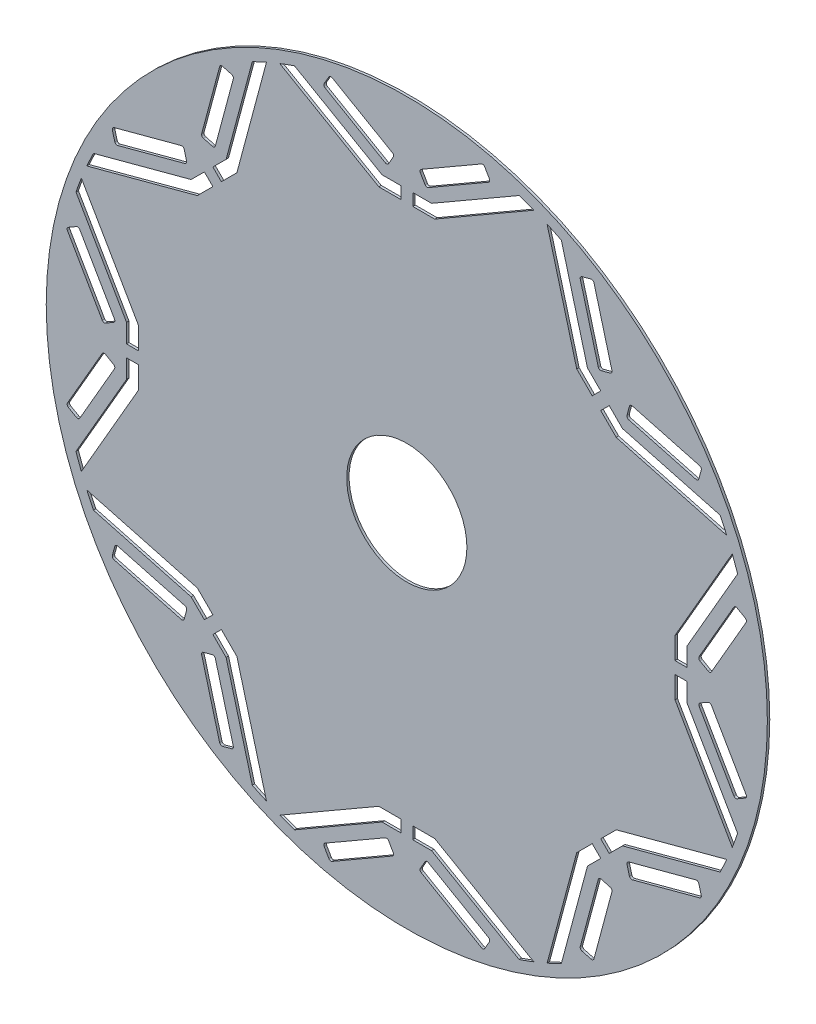
from build123d import *

# Parameters (mm, degrees)
ROTOR_SKETCH_R      = 45
ROTOR_SKETCH_R_2    = 7.5
BOSS_EXTRUDE1_DEPTH = 0.15
CUT_EXTRUDE1_DEPTH  = 64.64031741


with BuildPart() as part:
    # Rotor sketch → Boss-Extrude1 (new, symmetric)
    with BuildSketch(Plane.XY):
        Circle(ROTOR_SKETCH_R)
        Circle(ROTOR_SKETCH_R_2, mode=Mode.SUBTRACT)
        with BuildLine():
            Line((2.683949748, 36.477135035), (10.201050252, 40.817135035))
            ThreePointArc((10.201050252, 40.817135035), (10.340828, 40.999296943), (10.310857874, 41.226942656))
            Line((10.310857874, 41.226942656), (9.725857874, 42.240192379))
            ThreePointArc((9.725857874, 42.240192379), (9.543695966, 42.379970127), (9.316050252, 42.35))
            Line((9.316050252, 42.35), (1.798949748, 38.01))
            ThreePointArc((1.798949748, 38.01), (1.659172, 37.827838092), (1.689142126, 37.600192379))
            Line((1.689142126, 37.600192379), (2.274142126, 36.586942656))
            ThreePointArc((2.274142126, 36.586942656), (2.456304034, 36.447164909), (2.683949748, 36.477135035))
        make_face(mode=Mode.SUBTRACT)
        with BuildLine():
            Line((-1.798949748, 38.01), (-9.316050252, 42.35))
            ThreePointArc((-9.316050252, 42.35), (-9.543695966, 42.379970127), (-9.725857874, 42.240192379))
            Line((-9.725857874, 42.240192379), (-10.310857874, 41.226942656))
            ThreePointArc((-10.310857874, 41.226942656), (-10.340828, 40.999296943), (-10.201050252, 40.817135035))
            Line((-10.201050252, 40.817135035), (-2.683949748, 36.477135035))
            ThreePointArc((-2.683949748, 36.477135035), (-2.456304034, 36.447164909), (-2.274142126, 36.586942656))
            Line((-2.274142126, 36.586942656), (-1.689142126, 37.600192379))
            ThreePointArc((-1.689142126, 37.600192379), (-1.659172, 37.827838092), (-1.798949748, 38.01))
        make_face(mode=Mode.SUBTRACT)
        with BuildLine():
            Line((25.605079187, 28.149178318), (23.358529876, 36.533414491))
            ThreePointArc((23.358529876, 36.533414491), (23.218752128, 36.715576398), (22.991106414, 36.745546525))
            Line((22.991106414, 36.745546525), (21.860973198, 36.442728242))
            ThreePointArc((21.860973198, 36.442728242), (21.67881129, 36.302950494), (21.648841163, 36.075304781))
            Line((21.648841163, 36.075304781), (23.895390475, 27.691068609))
            ThreePointArc((23.895390475, 27.691068609), (24.035168223, 27.508906701), (24.262813936, 27.478936574))
            Line((24.262813936, 27.478936574), (25.392947153, 27.781754857))
            ThreePointArc((25.392947153, 27.781754857), (25.575109061, 27.921532605), (25.605079187, 28.149178318))
        make_face(mode=Mode.SUBTRACT)
        with BuildLine():
            Line((27.478936574, 24.262813936), (27.781754857, 25.392947153))
            ThreePointArc((27.781754857, 25.392947153), (27.921532605, 25.575109061), (28.149178318, 25.605079187))
            Line((28.149178318, 25.605079187), (36.533414491, 23.358529876))
            ThreePointArc((36.533414491, 23.358529876), (36.715576398, 23.218752128), (36.745546525, 22.991106414))
            Line((36.745546525, 22.991106414), (36.442728242, 21.860973198))
            ThreePointArc((36.442728242, 21.860973198), (36.302950494, 21.67881129), (36.075304781, 21.648841163))
            Line((36.075304781, 21.648841163), (27.691068609, 23.895390475))
            ThreePointArc((27.691068609, 23.895390475), (27.508906701, 24.035168223), (27.478936574, 24.262813936))
        make_face(mode=Mode.SUBTRACT)
        with BuildLine():
            Line((38.01, 1.798949748), (42.35, 9.316050252))
            ThreePointArc((42.35, 9.316050252), (42.379970127, 9.543695966), (42.240192379, 9.725857874))
            Line((42.240192379, 9.725857874), (41.226942656, 10.310857874))
            ThreePointArc((41.226942656, 10.310857874), (40.999296943, 10.340828), (40.817135035, 10.201050252))
            Line((40.817135035, 10.201050252), (36.477135035, 2.683949748))
            ThreePointArc((36.477135035, 2.683949748), (36.447164909, 2.456304034), (36.586942656, 2.274142126))
            Line((36.586942656, 2.274142126), (37.600192379, 1.689142126))
            ThreePointArc((37.600192379, 1.689142126), (37.827838092, 1.659172), (38.01, 1.798949748))
        make_face(mode=Mode.SUBTRACT)
        with BuildLine():
            Line((36.586942656, -2.274142126), (37.600192379, -1.689142126))
            ThreePointArc((37.600192379, -1.689142126), (37.827838092, -1.659172), (38.01, -1.798949748))
            Line((38.01, -1.798949748), (42.35, -9.316050252))
            ThreePointArc((42.35, -9.316050252), (42.379970127, -9.543695966), (42.240192379, -9.725857874))
            Line((42.240192379, -9.725857874), (41.226942656, -10.310857874))
            ThreePointArc((41.226942656, -10.310857874), (40.999296943, -10.340828), (40.817135035, -10.201050252))
            Line((40.817135035, -10.201050252), (36.477135035, -2.683949748))
            ThreePointArc((36.477135035, -2.683949748), (36.447164909, -2.456304034), (36.586942656, -2.274142126))
        make_face(mode=Mode.SUBTRACT)
        with BuildLine():
            Line((28.149178318, -25.605079187), (36.533414491, -23.358529876))
            ThreePointArc((36.533414491, -23.358529876), (36.715576398, -23.218752128), (36.745546525, -22.991106414))
            Line((36.745546525, -22.991106414), (36.442728242, -21.860973198))
            ThreePointArc((36.442728242, -21.860973198), (36.302950494, -21.67881129), (36.075304781, -21.648841163))
            Line((36.075304781, -21.648841163), (27.691068609, -23.895390475))
            ThreePointArc((27.691068609, -23.895390475), (27.508906701, -24.035168223), (27.478936574, -24.262813936))
            Line((27.478936574, -24.262813936), (27.781754857, -25.392947153))
            ThreePointArc((27.781754857, -25.392947153), (27.921532605, -25.575109061), (28.149178318, -25.605079187))
        make_face(mode=Mode.SUBTRACT)
        with BuildLine():
            Line((24.262813936, -27.478936574), (25.392947153, -27.781754857))
            ThreePointArc((25.392947153, -27.781754857), (25.575109061, -27.921532605), (25.605079187, -28.149178318))
            Line((25.605079187, -28.149178318), (23.358529876, -36.533414491))
            ThreePointArc((23.358529876, -36.533414491), (23.218752128, -36.715576398), (22.991106414, -36.745546525))
            Line((22.991106414, -36.745546525), (21.860973198, -36.442728242))
            ThreePointArc((21.860973198, -36.442728242), (21.67881129, -36.302950494), (21.648841163, -36.075304781))
            Line((21.648841163, -36.075304781), (23.895390475, -27.691068609))
            ThreePointArc((23.895390475, -27.691068609), (24.035168223, -27.508906701), (24.262813936, -27.478936574))
        make_face(mode=Mode.SUBTRACT)
        with BuildLine():
            Line((1.798949748, -38.01), (9.316050252, -42.35))
            ThreePointArc((9.316050252, -42.35), (9.543695966, -42.379970127), (9.725857874, -42.240192379))
            Line((9.725857874, -42.240192379), (10.310857874, -41.226942656))
            ThreePointArc((10.310857874, -41.226942656), (10.340828, -40.999296943), (10.201050252, -40.817135035))
            Line((10.201050252, -40.817135035), (2.683949748, -36.477135035))
            ThreePointArc((2.683949748, -36.477135035), (2.456304034, -36.447164909), (2.274142126, -36.586942656))
            Line((2.274142126, -36.586942656), (1.689142126, -37.600192379))
            ThreePointArc((1.689142126, -37.600192379), (1.659172, -37.827838092), (1.798949748, -38.01))
        make_face(mode=Mode.SUBTRACT)
        with BuildLine():
            Line((-2.274142126, -36.586942656), (-1.689142126, -37.600192379))
            ThreePointArc((-1.689142126, -37.600192379), (-1.659172, -37.827838092), (-1.798949748, -38.01))
            Line((-1.798949748, -38.01), (-9.316050252, -42.35))
            ThreePointArc((-9.316050252, -42.35), (-9.543695966, -42.379970127), (-9.725857874, -42.240192379))
            Line((-9.725857874, -42.240192379), (-10.310857874, -41.226942656))
            ThreePointArc((-10.310857874, -41.226942656), (-10.340828, -40.999296943), (-10.201050252, -40.817135035))
            Line((-10.201050252, -40.817135035), (-2.683949748, -36.477135035))
            ThreePointArc((-2.683949748, -36.477135035), (-2.456304034, -36.447164909), (-2.274142126, -36.586942656))
        make_face(mode=Mode.SUBTRACT)
        with BuildLine():
            Line((-25.605079187, -28.149178318), (-23.358529876, -36.533414491))
            ThreePointArc((-23.358529876, -36.533414491), (-23.218752128, -36.715576398), (-22.991106414, -36.745546525))
            Line((-22.991106414, -36.745546525), (-21.860973198, -36.442728242))
            ThreePointArc((-21.860973198, -36.442728242), (-21.67881129, -36.302950494), (-21.648841163, -36.075304781))
            Line((-21.648841163, -36.075304781), (-23.895390475, -27.691068609))
            ThreePointArc((-23.895390475, -27.691068609), (-24.035168223, -27.508906701), (-24.262813936, -27.478936574))
            Line((-24.262813936, -27.478936574), (-25.392947153, -27.781754857))
            ThreePointArc((-25.392947153, -27.781754857), (-25.575109061, -27.921532605), (-25.605079187, -28.149178318))
        make_face(mode=Mode.SUBTRACT)
        with BuildLine():
            Line((-27.478936574, -24.262813936), (-27.781754857, -25.392947153))
            ThreePointArc((-27.781754857, -25.392947153), (-27.921532605, -25.575109061), (-28.149178318, -25.605079187))
            Line((-28.149178318, -25.605079187), (-36.533414491, -23.358529876))
            ThreePointArc((-36.533414491, -23.358529876), (-36.715576398, -23.218752128), (-36.745546525, -22.991106414))
            Line((-36.745546525, -22.991106414), (-36.442728242, -21.860973198))
            ThreePointArc((-36.442728242, -21.860973198), (-36.302950494, -21.67881129), (-36.075304781, -21.648841163))
            Line((-36.075304781, -21.648841163), (-27.691068609, -23.895390475))
            ThreePointArc((-27.691068609, -23.895390475), (-27.508906701, -24.035168223), (-27.478936574, -24.262813936))
        make_face(mode=Mode.SUBTRACT)
        with BuildLine():
            Line((-38.01, -1.798949748), (-42.35, -9.316050252))
            ThreePointArc((-42.35, -9.316050252), (-42.379970127, -9.543695966), (-42.240192379, -9.725857874))
            Line((-42.240192379, -9.725857874), (-41.226942656, -10.310857874))
            ThreePointArc((-41.226942656, -10.310857874), (-40.999296943, -10.340828), (-40.817135035, -10.201050252))
            Line((-40.817135035, -10.201050252), (-36.477135035, -2.683949748))
            ThreePointArc((-36.477135035, -2.683949748), (-36.447164909, -2.456304034), (-36.586942656, -2.274142126))
            Line((-36.586942656, -2.274142126), (-37.600192379, -1.689142126))
            ThreePointArc((-37.600192379, -1.689142126), (-37.827838092, -1.659172), (-38.01, -1.798949748))
        make_face(mode=Mode.SUBTRACT)
        with BuildLine():
            Line((-36.586942656, 2.274142126), (-37.600192379, 1.689142126))
            ThreePointArc((-37.600192379, 1.689142126), (-37.827838092, 1.659172), (-38.01, 1.798949748))
            Line((-38.01, 1.798949748), (-42.35, 9.316050252))
            ThreePointArc((-42.35, 9.316050252), (-42.379970127, 9.543695966), (-42.240192379, 9.725857874))
            Line((-42.240192379, 9.725857874), (-41.226942656, 10.310857874))
            ThreePointArc((-41.226942656, 10.310857874), (-40.999296943, 10.340828), (-40.817135035, 10.201050252))
            Line((-40.817135035, 10.201050252), (-36.477135035, 2.683949748))
            ThreePointArc((-36.477135035, 2.683949748), (-36.447164909, 2.456304034), (-36.586942656, 2.274142126))
        make_face(mode=Mode.SUBTRACT)
        with BuildLine():
            Line((-28.149178318, 25.605079187), (-36.533414491, 23.358529876))
            ThreePointArc((-36.533414491, 23.358529876), (-36.715576398, 23.218752128), (-36.745546525, 22.991106414))
            Line((-36.745546525, 22.991106414), (-36.442728242, 21.860973198))
            ThreePointArc((-36.442728242, 21.860973198), (-36.302950494, 21.67881129), (-36.075304781, 21.648841163))
            Line((-36.075304781, 21.648841163), (-27.691068609, 23.895390475))
            ThreePointArc((-27.691068609, 23.895390475), (-27.508906701, 24.035168223), (-27.478936574, 24.262813936))
            Line((-27.478936574, 24.262813936), (-27.781754857, 25.392947153))
            ThreePointArc((-27.781754857, 25.392947153), (-27.921532605, 25.575109061), (-28.149178318, 25.605079187))
        make_face(mode=Mode.SUBTRACT)
        with BuildLine():
            Line((-24.262813936, 27.478936574), (-25.392947153, 27.781754857))
            ThreePointArc((-25.392947153, 27.781754857), (-25.575109061, 27.921532605), (-25.605079187, 28.149178318))
            Line((-25.605079187, 28.149178318), (-23.358529876, 36.533414491))
            ThreePointArc((-23.358529876, 36.533414491), (-23.218752128, 36.715576398), (-22.991106414, 36.745546525))
            Line((-22.991106414, 36.745546525), (-21.860973198, 36.442728242))
            ThreePointArc((-21.860973198, 36.442728242), (-21.67881129, 36.302950494), (-21.648841163, 36.075304781))
            Line((-21.648841163, 36.075304781), (-23.895390475, 27.691068609))
            ThreePointArc((-23.895390475, 27.691068609), (-24.035168223, 27.508906701), (-24.262813936, 27.478936574))
        make_face(mode=Mode.SUBTRACT)
    extrude(amount=BOSS_EXTRUDE1_DEPTH, both=True)

    # Saliency grooves → Cut-Extrude1 (cut, through all)
    with BuildSketch(Plane.XY.offset(0.15)):
        with BuildLine():
            Line((-26.914611473, 22.550527267), (-39.103255501, 19.284589943))
            ThreePointArc((-39.103255501, 19.284589943), (-39.526227723, 18.402101022), (-39.929286869, 17.510341234))
            Line((-39.929286869, 17.510341234), (-36.565989077, 18.411534161))
            Line((-36.565989077, 18.411534161), (-26.138154338, 21.205664058))
            Line((-26.138154338, 21.205664058), (-24.202239284, 23.141579112))
            Line((-24.202239284, 23.141579112), (-25.262899456, 24.202239284))
            Line((-25.262899456, 24.202239284), (-26.914611473, 22.550527267))
        make_face()
        with BuildLine():
            Line((-18.411534161, 36.565989077), (-17.510341234, 39.929286869))
            ThreePointArc((-17.510341234, 39.929286869), (-18.402101022, 39.526227723), (-19.284589943, 39.103255501))
            Line((-19.284589943, 39.103255501), (-22.550527267, 26.914611473))
            Line((-22.550527267, 26.914611473), (-24.202239284, 25.262899456))
            Line((-24.202239284, 25.262899456), (-23.141579112, 24.202239284))
            Line((-23.141579112, 24.202239284), (-21.205664058, 26.138154338))
            Line((-21.205664058, 26.138154338), (-18.411534161, 36.565989077))
        make_face()
        with BuildLine():
            ThreePointArc((15.852588486, 40.61595054), (14.937013237, 40.961514078), (14.01391281, 41.286441452))
            Line((14.01391281, 41.286441452), (3.085873536, 34.977135035))
            Line((3.085873536, 34.977135035), (0.75, 34.977135035))
            Line((0.75, 34.977135035), (0.75, 33.477135035))
            Line((0.75, 33.477135035), (3.487797325, 33.477135035))
            Line((3.487797325, 33.477135035), (12.83713818, 38.874979495))
            Line((12.83713818, 38.874979495), (15.852588486, 40.61595054))
        make_face()
        with BuildLine():
            Line((-15.852588486, 40.61595054), (-12.83713818, 38.874979495))
            Line((-12.83713818, 38.874979495), (-3.487797325, 33.477135035))
            Line((-3.487797325, 33.477135035), (-0.75, 33.477135035))
            Line((-0.75, 33.477135035), (-0.75, 34.977135035))
            Line((-0.75, 34.977135035), (-3.085873536, 34.977135035))
            Line((-3.085873536, 34.977135035), (-14.01391281, 41.286441452))
            ThreePointArc((-14.01391281, 41.286441452), (-14.937013237, 40.961514078), (-15.852588486, 40.61595054))
        make_face()
        with BuildLine():
            ThreePointArc((19.284589943, 39.103255501), (18.402101022, 39.526227723), (17.510341234, 39.929286869))
            Line((17.510341234, 39.929286869), (18.411534161, 36.565989077))
            Line((18.411534161, 36.565989077), (21.205664058, 26.138154338))
            Line((21.205664058, 26.138154338), (23.141579112, 24.202239284))
            Line((23.141579112, 24.202239284), (24.202239284, 25.262899456))
            Line((24.202239284, 25.262899456), (22.550527267, 26.914611473))
            Line((22.550527267, 26.914611473), (19.284589943, 39.103255501))
        make_face()
        with BuildLine():
            ThreePointArc((39.929286869, 17.510341234), (39.526227723, 18.402101022), (39.103255501, 19.284589943))
            Line((39.103255501, 19.284589943), (26.914611473, 22.550527267))
            Line((26.914611473, 22.550527267), (25.262899456, 24.202239284))
            Line((25.262899456, 24.202239284), (24.202239284, 23.141579112))
            Line((24.202239284, 23.141579112), (26.138154338, 21.205664058))
            Line((26.138154338, 21.205664058), (36.565989077, 18.411534161))
            Line((36.565989077, 18.411534161), (39.929286869, 17.510341234))
        make_face()
        with BuildLine():
            ThreePointArc((41.286441452, 14.01391281), (40.961514078, 14.937013237), (40.61595054, 15.852588486))
            Line((40.61595054, 15.852588486), (38.874979495, 12.83713818))
            Line((38.874979495, 12.83713818), (33.477135035, 3.487797325))
            Line((33.477135035, 3.487797325), (33.477135035, 0.75))
            Line((33.477135035, 0.75), (34.977135035, 0.75))
            Line((34.977135035, 0.75), (34.977135035, 3.085873536))
            Line((34.977135035, 3.085873536), (41.286441452, 14.01391281))
        make_face()
        with BuildLine():
            ThreePointArc((40.61595054, -15.852588486), (40.961514078, -14.937013237), (41.286441452, -14.01391281))
            Line((41.286441452, -14.01391281), (34.977135035, -3.085873536))
            Line((34.977135035, -3.085873536), (34.977135035, -0.75))
            Line((34.977135035, -0.75), (33.477135035, -0.75))
            Line((33.477135035, -0.75), (33.477135035, -3.487797325))
            Line((33.477135035, -3.487797325), (38.874979495, -12.83713818))
            Line((38.874979495, -12.83713818), (40.61595054, -15.852588486))
        make_face()
        with BuildLine():
            Line((-38.874979495, 12.83713818), (-40.61595054, 15.852588486))
            ThreePointArc((-40.61595054, 15.852588486), (-40.961514078, 14.937013237), (-41.286441452, 14.01391281))
            Line((-41.286441452, 14.01391281), (-34.977135035, 3.085873536))
            Line((-34.977135035, 3.085873536), (-34.977135035, 0.75))
            Line((-34.977135035, 0.75), (-33.477135035, 0.75))
            Line((-33.477135035, 0.75), (-33.477135035, 3.487797325))
            Line((-33.477135035, 3.487797325), (-38.874979495, 12.83713818))
        make_face()
        with BuildLine():
            Line((-34.977135035, -3.085873536), (-41.286441452, -14.01391281))
            ThreePointArc((-41.286441452, -14.01391281), (-40.961514078, -14.937013237), (-40.61595054, -15.852588486))
            Line((-40.61595054, -15.852588486), (-38.874979495, -12.83713818))
            Line((-38.874979495, -12.83713818), (-33.477135035, -3.487797325))
            Line((-33.477135035, -3.487797325), (-33.477135035, -0.75))
            Line((-33.477135035, -0.75), (-34.977135035, -0.75))
            Line((-34.977135035, -0.75), (-34.977135035, -3.085873536))
        make_face()
        with BuildLine():
            Line((-36.565989077, -18.411534161), (-39.929286869, -17.510341234))
            ThreePointArc((-39.929286869, -17.510341234), (-39.526227723, -18.402101022), (-39.103255501, -19.284589943))
            Line((-39.103255501, -19.284589943), (-26.914611473, -22.550527267))
            Line((-26.914611473, -22.550527267), (-25.262899456, -24.202239284))
            Line((-25.262899456, -24.202239284), (-24.202239284, -23.141579112))
            Line((-24.202239284, -23.141579112), (-26.138154338, -21.205664058))
            Line((-26.138154338, -21.205664058), (-36.565989077, -18.411534161))
        make_face()
        with BuildLine():
            Line((-22.550527267, -26.914611473), (-19.284589943, -39.103255501))
            ThreePointArc((-19.284589943, -39.103255501), (-18.402101022, -39.526227723), (-17.510341234, -39.929286869))
            Line((-17.510341234, -39.929286869), (-18.411534161, -36.565989077))
            Line((-18.411534161, -36.565989077), (-21.205664058, -26.138154338))
            Line((-21.205664058, -26.138154338), (-23.141579112, -24.202239284))
            Line((-23.141579112, -24.202239284), (-24.202239284, -25.262899456))
            Line((-24.202239284, -25.262899456), (-22.550527267, -26.914611473))
        make_face()
        with BuildLine():
            Line((-12.83713818, -38.874979495), (-15.852588486, -40.61595054))
            ThreePointArc((-15.852588486, -40.61595054), (-14.937013237, -40.961514078), (-14.01391281, -41.286441452))
            Line((-14.01391281, -41.286441452), (-3.085873536, -34.977135035))
            Line((-3.085873536, -34.977135035), (-0.75, -34.977135035))
            Line((-0.75, -34.977135035), (-0.75, -33.477135035))
            Line((-0.75, -33.477135035), (-3.487797325, -33.477135035))
            Line((-3.487797325, -33.477135035), (-12.83713818, -38.874979495))
        make_face()
        with BuildLine():
            Line((3.085873536, -34.977135035), (14.01391281, -41.286441452))
            ThreePointArc((14.01391281, -41.286441452), (14.937013237, -40.961514078), (15.852588486, -40.61595054))
            Line((15.852588486, -40.61595054), (12.83713818, -38.874979495))
            Line((12.83713818, -38.874979495), (3.487797325, -33.477135035))
            Line((3.487797325, -33.477135035), (0.75, -33.477135035))
            Line((0.75, -33.477135035), (0.75, -34.977135035))
            Line((0.75, -34.977135035), (3.085873536, -34.977135035))
        make_face()
        with BuildLine():
            ThreePointArc((17.510341234, -39.929286869), (18.402101022, -39.526227723), (19.284589943, -39.103255501))
            Line((19.284589943, -39.103255501), (22.550527267, -26.914611473))
            Line((22.550527267, -26.914611473), (24.202239284, -25.262899456))
            Line((24.202239284, -25.262899456), (23.141579112, -24.202239284))
            Line((23.141579112, -24.202239284), (21.205664058, -26.138154338))
            Line((21.205664058, -26.138154338), (18.411534161, -36.565989077))
            Line((18.411534161, -36.565989077), (17.510341234, -39.929286869))
        make_face()
        with BuildLine():
            ThreePointArc((39.103255501, -19.284589943), (39.526227723, -18.402101022), (39.929286869, -17.510341234))
            Line((39.929286869, -17.510341234), (36.565989077, -18.411534161))
            Line((36.565989077, -18.411534161), (26.138154338, -21.205664058))
            Line((26.138154338, -21.205664058), (24.202239284, -23.141579112))
            Line((24.202239284, -23.141579112), (25.262899456, -24.202239284))
            Line((25.262899456, -24.202239284), (26.914611473, -22.550527267))
            Line((26.914611473, -22.550527267), (39.103255501, -19.284589943))
        make_face()
    extrude(amount=-CUT_EXTRUDE1_DEPTH, mode=Mode.SUBTRACT)


solid = part.part
